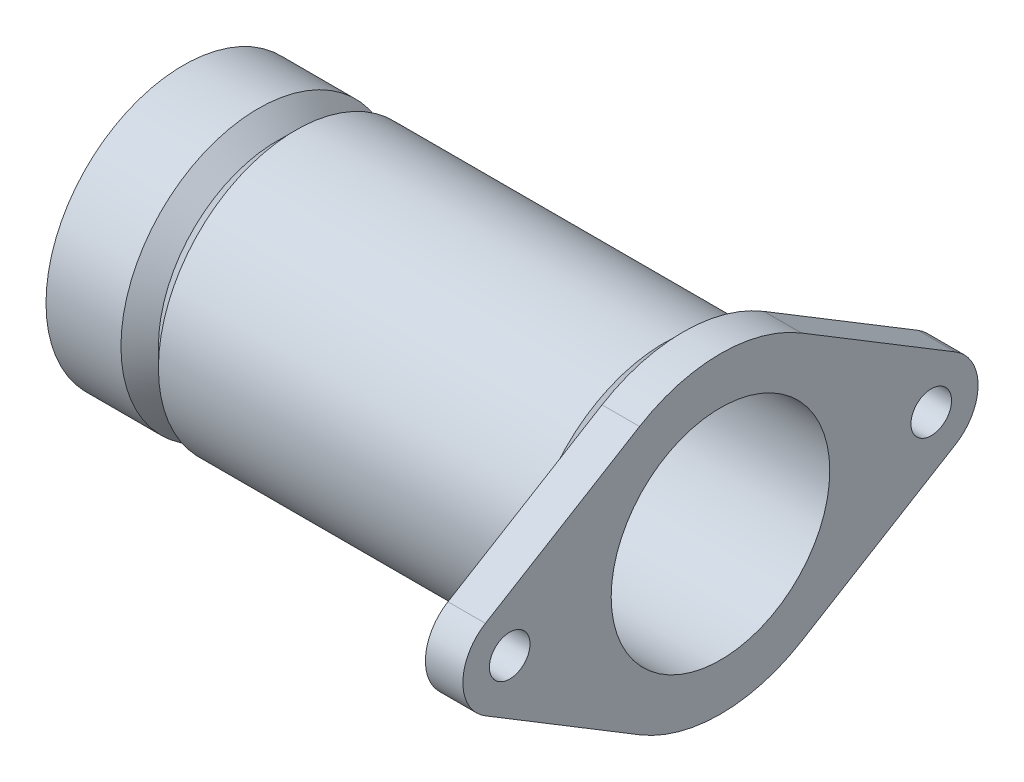
from build123d import *

# Parameters (mm, degrees)
SKETCH1_R           = 44
BOSS_EXTRUDE1_DEPTH = 160
BOSS_EXTRUDE2_DEPTH = 12
SKETCH5_R           = 6.5
CUT_EXTRUDE3_DEPTH  = 80
SKETCH6_R           = 35
CUT_EXTRUDE4_DEPTH  = 142
SKETCH7_R           = 25.5
CUT_EXTRUDE5_DEPTH  = 82


with BuildPart() as part:
    # Sketch1 → Boss-Extrude1 (new body)
    with BuildSketch(Plane(origin=(0, 0, 0), x_dir=(0, 0, -1), z_dir=(1, 0, 0))):
        Circle(SKETCH1_R)
    extrude(amount=BOSS_EXTRUDE1_DEPTH)

    # Sketch2 → Boss-Extrude2 (add)
    with BuildSketch(Plane(origin=(160, 0, 0), x_dir=(0, 0, -1), z_dir=(1, 0, 0))):
        with BuildLine():
            Line((-25.925925926, 42.753319928), (-75.277777778, 12.825995978))
            ThreePointArc((-75.277777778, 12.825995978), (-82.5, 0), (-75.277777778, -12.825995978))
            Line((-75.277777778, -12.825995978), (-25.925925926, -42.753319928))
            ThreePointArc((-25.925925926, -42.753319928), (0, -50), (25.925925926, -42.753319928))
            Line((25.925925926, -42.753319928), (75.277777778, -12.825995978))
            ThreePointArc((75.277777778, -12.825995978), (82.5, 0), (75.277777778, 12.825995978))
            Line((75.277777778, 12.825995978), (25.925925926, 42.753319928))
            ThreePointArc((25.925925926, 42.753319928), (0, 50), (-25.925925926, 42.753319928))
        make_face()
    extrude(amount=BOSS_EXTRUDE2_DEPTH)

    # Sketch5 → Cut-Extrude3 (cut)
    with BuildSketch(Plane(origin=(172, 0, 0), x_dir=(0, 0, -1), z_dir=(1, 0, 0))):
        with Locations((67.5, 0)):
            Circle(SKETCH5_R)
        with Locations((-67.5, 0)):
            Circle(SKETCH5_R)
    extrude(amount=-CUT_EXTRUDE3_DEPTH, mode=Mode.SUBTRACT)

    # Sketch6 → Cut-Extrude4 (cut)
    with BuildSketch(Plane(origin=(172, 0, 0), x_dir=(0, 0, -1), z_dir=(1, 0, 0))):
        Circle(SKETCH6_R)
    extrude(amount=-CUT_EXTRUDE4_DEPTH, mode=Mode.SUBTRACT)

    # Sketch7 → Cut-Extrude5 (cut)
    with BuildSketch(Plane.ZY):
        Circle(SKETCH7_R)
    extrude(amount=-CUT_EXTRUDE5_DEPTH, mode=Mode.SUBTRACT)

    # Sketch9 → Cut-Revolve1 (revolve, cut)
    with BuildSketch(Plane(origin=(0, 0, 0), x_dir=(1, 0, 0), z_dir=(0, 1, 0)), mode=Mode.PRIVATE) as cut_revolve1_sk:
        Polygon((30, 38.002095215), (23.999999428, 44.002095215), (35.999999428, 44.002095215), align=None)
        Polygon((160, 44.000612252), (160, 38.000612252), (154, 44.000612252), align=None)
    revolve(cut_revolve1_sk.sketch.rotate(Axis((0, 0, 0), (1, 0, 0)), 180), axis=Axis((0, 0, 0), (1, 0, 0)), mode=Mode.SUBTRACT)


solid = part.part
